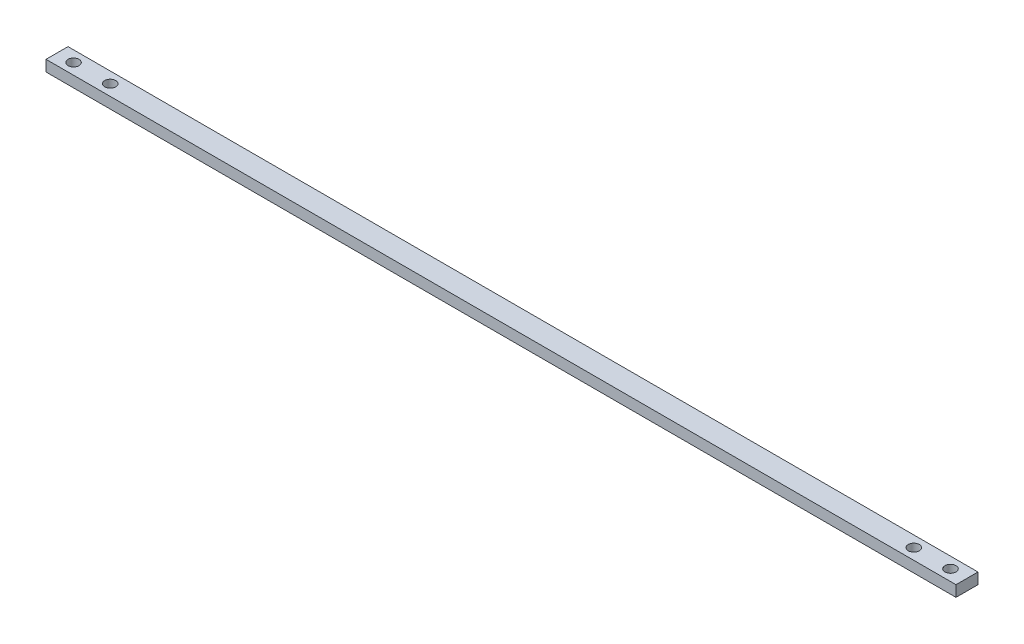
from build123d import *

# Parameters (mm, degrees)
SKETCH1_W           = 248
SKETCH1_H           = 6
SKETCH1_R           = 1.5
BOSS_EXTRUDE1_DEPTH = 3


with BuildPart() as part:
    # Sketch1 → Boss-Extrude1 (new body)
    with BuildSketch(Plane(origin=(0, 0, 0), x_dir=(1, 0, 0), z_dir=(0, 1, 0))):
        Rectangle(SKETCH1_W, SKETCH1_H)
        with Locations(Location((-119.5, 0, 0), (0, 0, 270))):
            Circle(SKETCH1_R, mode=Mode.SUBTRACT)
        with Locations(Location((119.5, 0, 0), (0, 0, 90))):
            Circle(SKETCH1_R, mode=Mode.SUBTRACT)
        with Locations(Location((-109.5, 0, 0), (0, 0, 270))):
            Circle(SKETCH1_R, mode=Mode.SUBTRACT)
        with Locations(Location((109.5, 0, 0), (0, 0, 90))):
            Circle(SKETCH1_R, mode=Mode.SUBTRACT)
    extrude(amount=BOSS_EXTRUDE1_DEPTH)


solid = part.part
